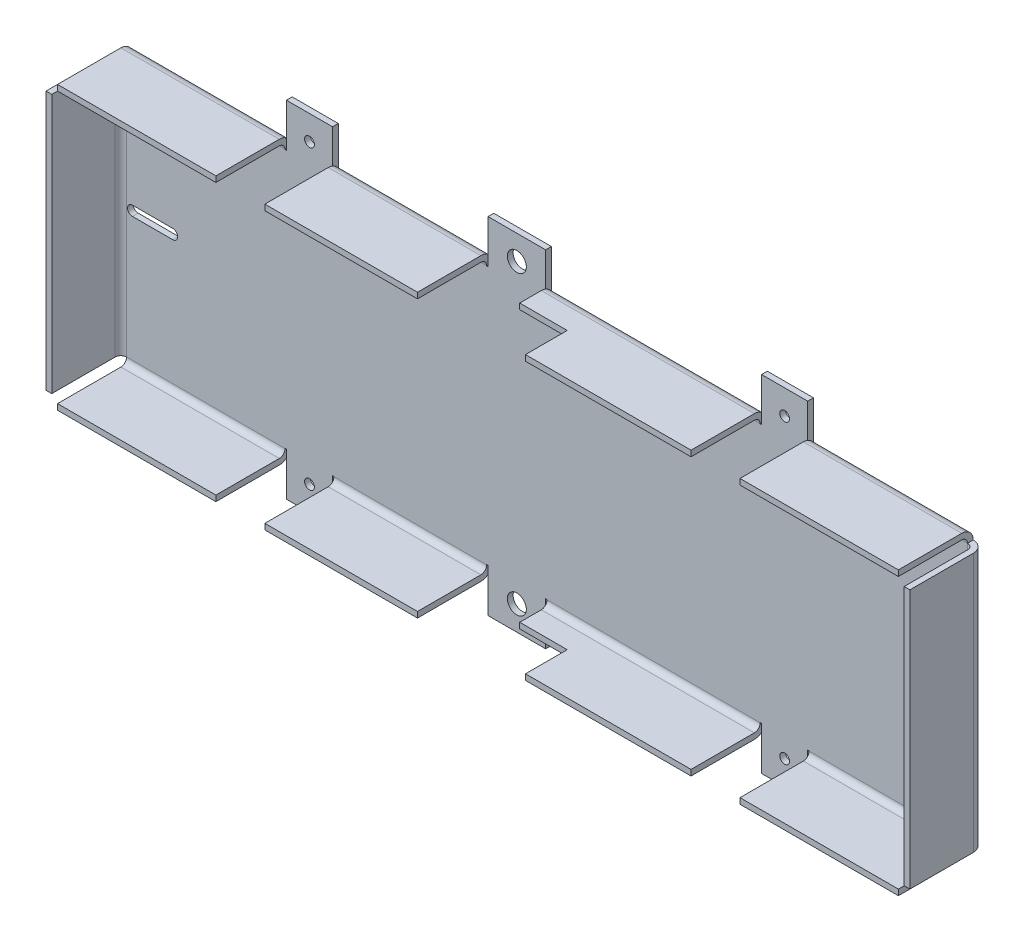
from build123d import *

# Parameters (mm, degrees)
TRAY_SECTION_DEPTH         = 292
REAR_WALL_DEPTH            = 90
FRONT_WALL_DEPTH           = 90
EAR_RELIEF_SKETCH_W        = 17
EAR_RELIEF_SKETCH_H        = 4.3
EAR_RELIEF_SKETCH_W_2      = 21
EAR_RELIEFS_DEPTH          = 26.4
MOUNTING_EAR_SKETCH_W      = 16
MOUNTING_EAR_SKETCH_H      = 15.2
MOUNTING_EAR_SKETCH_W_2    = 20
MOUNTING_EARS_DEPTH        = 2
TRAY_HOLE_SKETCH_R         = 1.7
TRAY_HOLE_SKETCH_R_2       = 3.3
TRAY_HOLES_AND_SLOTS_DEPTH = 2.4
CLAMP_CLEARANCE_SKETCH_W   = 33
CLAMP_CLEARANCE_SKETCH_H   = 14.7
CLAMP_CLEARANCE_DEPTH      = 130


with BuildPart() as part:
    # Tray Section Sketch → Tray Section (new body)
    with BuildSketch(Plane(origin=(-153.5, 0, 0), x_dir=(0, 0, -1), z_dir=(1, 0, 0))):
        with BuildLine():
            Line((-144, -49), (-122, -49))
            ThreePointArc((-122, -49), (-119.171572875, -47.828427125), (-118, -45))
            Line((-118, -45), (-118, 45))
            ThreePointArc((-118, 45), (-119.171572875, 47.828427125), (-122, 49))
            Line((-122, 49), (-144, 49))
            Line((-144, 49), (-144, 47))
            Line((-144, 47), (-122, 47))
            ThreePointArc((-122, 47), (-120.585786438, 46.414213562), (-120, 45))
            Line((-120, 45), (-120, -45))
            ThreePointArc((-120, -45), (-120.585786438, -46.414213562), (-122, -47))
            Line((-122, -47), (-144, -47))
            Line((-144, -47), (-144, -49))
        make_face()
    extrude(amount=TRAY_SECTION_DEPTH)

    # Rear Wall Sketch → Rear Wall (add)
    with BuildSketch(Plane(origin=(0, -45, 0), x_dir=(-1, 0, 0), z_dir=(0, -1, 0))):
        with BuildLine():
            Line((157.5, -122), (157.5, -144))
            Line((157.5, -144), (155.5, -144))
            Line((155.5, -144), (155.5, -122))
            ThreePointArc((155.5, -122), (154.914213562, -120.585786438), (153.5, -120))
            Line((153.5, -120), (153.5, -118))
            ThreePointArc((153.5, -118), (156.328427125, -119.171572875), (157.5, -122))
        make_face()
    extrude(amount=-REAR_WALL_DEPTH)

    # Front Wall Sketch → Front Wall (add)
    with BuildSketch(Plane(origin=(0, -45, 0), x_dir=(-1, 0, 0), z_dir=(0, -1, 0))):
        with BuildLine():
            Line((-142.5, -122), (-142.5, -144))
            Line((-142.5, -144), (-140.5, -144))
            Line((-140.5, -144), (-140.5, -122))
            ThreePointArc((-140.5, -122), (-139.914213562, -120.585786438), (-138.5, -120))
            Line((-138.5, -120), (-138.5, -118))
            ThreePointArc((-138.5, -118), (-141.328427125, -119.171572875), (-142.5, -122))
        make_face()
    extrude(amount=-FRONT_WALL_DEPTH)

    # Ear Relief Sketch → Ear Reliefs (cut)
    with BuildSketch(Plane.XY.offset(117.8)):
        with Locations((-90, -47.05)):
            Rectangle(EAR_RELIEF_SKETCH_W, EAR_RELIEF_SKETCH_H)
        with Locations((-90, 47.05)):
            Rectangle(EAR_RELIEF_SKETCH_W, EAR_RELIEF_SKETCH_H)
        with Locations((75, -47.05)):
            Rectangle(EAR_RELIEF_SKETCH_W, EAR_RELIEF_SKETCH_H)
        with Locations((75, 47.05)):
            Rectangle(EAR_RELIEF_SKETCH_W, EAR_RELIEF_SKETCH_H)
        with Locations((-18, -47.05)):
            Rectangle(EAR_RELIEF_SKETCH_W_2, EAR_RELIEF_SKETCH_H)
        with Locations((-18, 47.05)):
            Rectangle(EAR_RELIEF_SKETCH_W_2, EAR_RELIEF_SKETCH_H)
    extrude(amount=EAR_RELIEFS_DEPTH, mode=Mode.SUBTRACT)

    # Mounting Ear Sketch → Mounting Ears (add)
    with BuildSketch(Plane.XY.offset(118)):
        with Locations((-90, -52.4)):
            Rectangle(MOUNTING_EAR_SKETCH_W, MOUNTING_EAR_SKETCH_H)
        with Locations((-90, 52.4)):
            Rectangle(MOUNTING_EAR_SKETCH_W, MOUNTING_EAR_SKETCH_H)
        with Locations((75, -52.4)):
            Rectangle(MOUNTING_EAR_SKETCH_W, MOUNTING_EAR_SKETCH_H)
        with Locations((75, 52.4)):
            Rectangle(MOUNTING_EAR_SKETCH_W, MOUNTING_EAR_SKETCH_H)
        with Locations((-18, -52.4)):
            Rectangle(MOUNTING_EAR_SKETCH_W_2, MOUNTING_EAR_SKETCH_H)
        with Locations((-18, 52.4)):
            Rectangle(MOUNTING_EAR_SKETCH_W_2, MOUNTING_EAR_SKETCH_H)
    extrude(amount=MOUNTING_EARS_DEPTH)

    # Tray Hole Sketch → Tray Holes and Slots (cut)
    with BuildSketch(Plane.XY.offset(117.8)):
        with Locations(Location((-90, -51.5, 0), (0, 0, 180))):
            Circle(TRAY_HOLE_SKETCH_R)
        with Locations(Location((-90, 51.5, 0), (0, 0, 180))):
            Circle(TRAY_HOLE_SKETCH_R)
        with Locations(Location((75, -51.5, 0), (0, 0, 180))):
            Circle(TRAY_HOLE_SKETCH_R)
        with Locations(Location((75, 51.5, 0), (0, 0, 180))):
            Circle(TRAY_HOLE_SKETCH_R)
        with Locations(Location((-18, -51.5, 0), (0, 0, 180))):
            Circle(TRAY_HOLE_SKETCH_R_2)
        with Locations(Location((-18, 51.5, 0), (0, 0, 180))):
            Circle(TRAY_HOLE_SKETCH_R_2)
        with BuildLine():
            Line((-151.5, -1.7), (-137.5, -1.7))
            ThreePointArc((-137.5, -1.7), (-135.8, 0), (-137.5, 1.7))
            Line((-137.5, 1.7), (-151.5, 1.7))
            ThreePointArc((-151.5, 1.7), (-153.2, 0), (-151.5, -1.7))
        make_face()
        with BuildLine():
            Line((122.5, -1.7), (136.5, -1.7))
            ThreePointArc((136.5, -1.7), (138.2, 0), (136.5, 1.7))
            Line((136.5, 1.7), (122.5, 1.7))
            ThreePointArc((122.5, 1.7), (120.8, 0), (122.5, -1.7))
        make_face()
    extrude(amount=TRAY_HOLES_AND_SLOTS_DEPTH, mode=Mode.SUBTRACT)

    # Clamp Clearance Sketch → Clamp Clearance (cut)
    with BuildSketch(Plane(origin=(0, -65, 0), x_dir=(-1, 0, 0), z_dir=(0, -1, 0))):
        with Locations((7.5, -136.85)):
            Rectangle(CLAMP_CLEARANCE_SKETCH_W, CLAMP_CLEARANCE_SKETCH_H)
    extrude(amount=-CLAMP_CLEARANCE_DEPTH, mode=Mode.SUBTRACT)


solid = part.part
